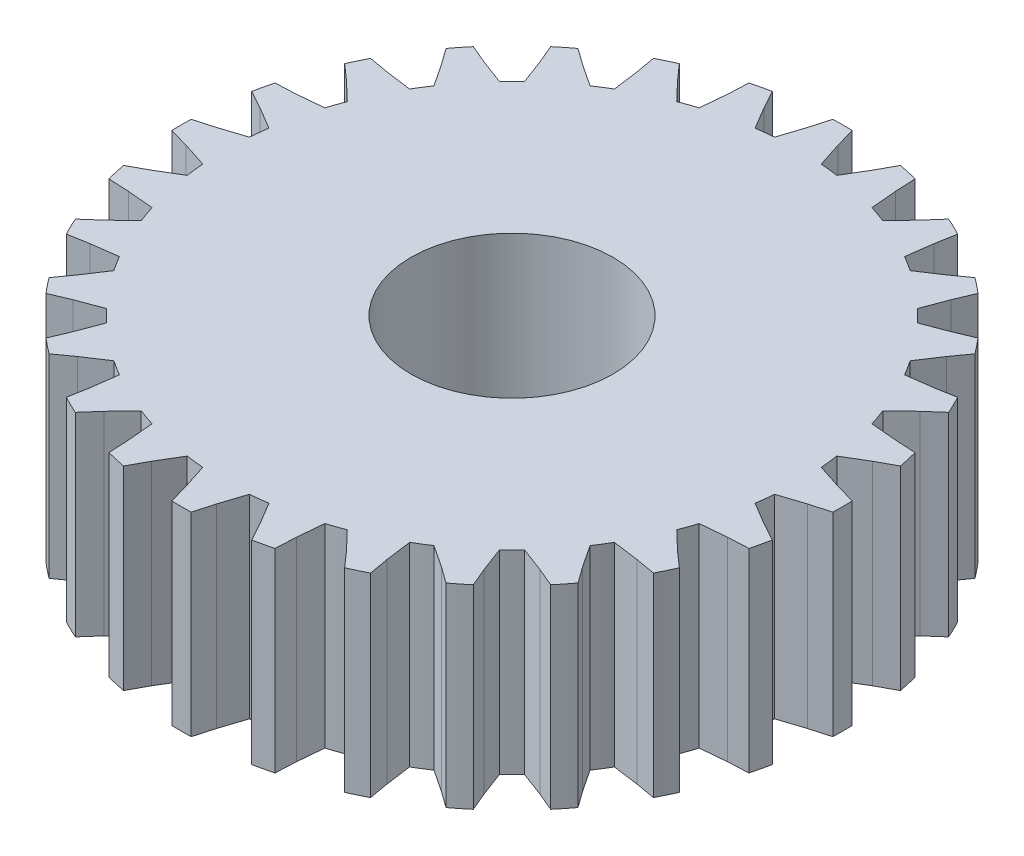
from build123d import *

# Parameters (mm, degrees)
SKETCH2_R           = 2.6
BOSS_EXTRUDE1_DEPTH = 5
CIRPATTERN1_COUNT   = 28


with BuildPart() as part:
    # Sketch2 → Boss-Extrude1 (new body)
    with BuildSketch(Plane(origin=(0, 0, 0), x_dir=(1, 0, 0), z_dir=(0, 1, 0))):
        with BuildLine():
            Line((0.6, 7.3505527), (0.3925, 7.990365683))
            Line((0.3925, 7.990365683), (0.25, 8.496322734))
            ThreePointArc((0.25, 8.496322734), (0, 8.5), (-0.25, 8.496322734))
            Line((-0.25, 8.496322734), (-0.3925, 7.990365683))
            Line((-0.3925, 7.990365683), (-0.6, 7.3505527))
            ThreePointArc((-0.6, 7.3505527), (0, -7.375), (0.6, 7.3505527))
        make_face()
        with Locations(Location((0, 0, 0), (0, 0, 270))):
            Circle(SKETCH2_R, mode=Mode.SUBTRACT)
    boss_extrude1 = extrude(amount=BOSS_EXTRUDE1_DEPTH)

    # CirPattern1: Boss-Extrude1 ×28 about axis
    cirpattern1_axis = Axis((0, 0, 0), (0, 1, 0))
    for i in range(1, CIRPATTERN1_COUNT):
        add(boss_extrude1.rotate(cirpattern1_axis, i * 360 / CIRPATTERN1_COUNT))


solid = part.part
